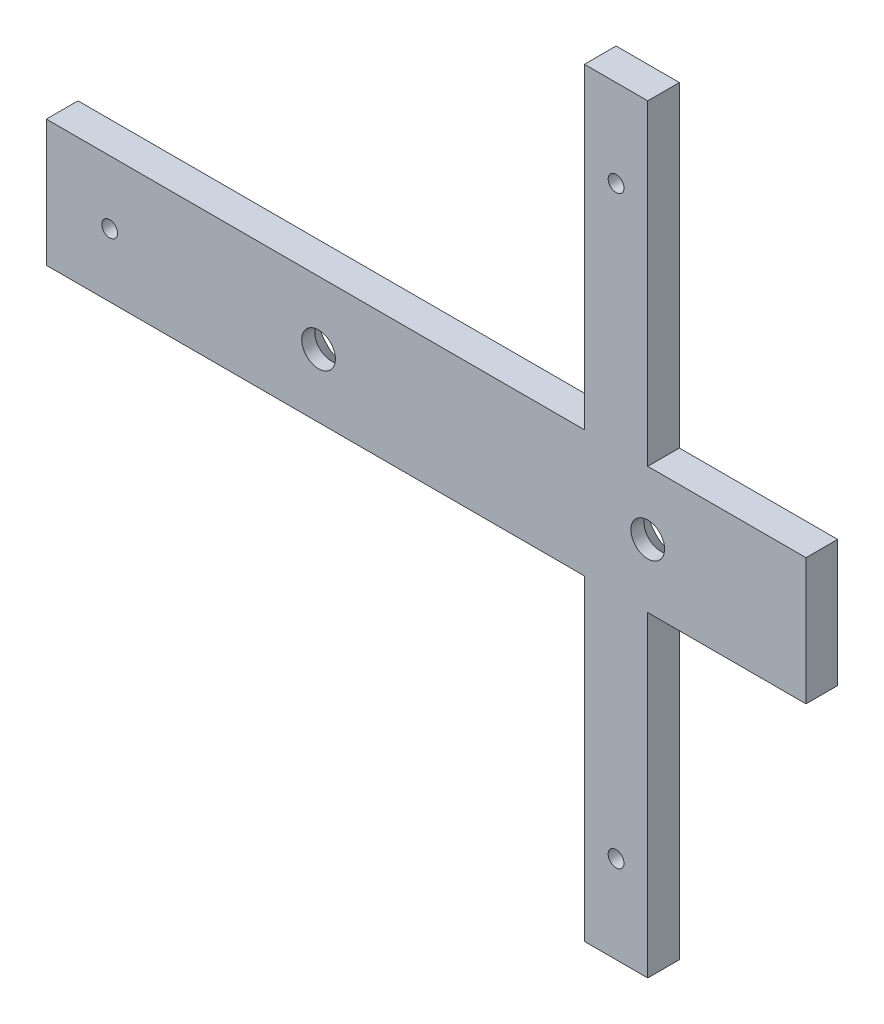
from build123d import *

# Parameters (mm, degrees)
SKETCH1_W         = 152.4
SKETCH1_H         = 152.4
EXTRUDE1_DEPTH    = 6.35
SKETCH2_R         = 1.5875
EXTRUDE2_DEPTH    = 108.95
SKETCH3_OUTSIDE_W = 197.524
SKETCH3_OUTSIDE_H = 197.524
EXTRUDE3_DEPTH    = 108.95


with BuildPart() as part:
    # Sketch1 → Extrude1 (new body)
    with BuildSketch(Plane.XY):
        Rectangle(SKETCH1_W, SKETCH1_H)
    extrude(amount=EXTRUDE1_DEPTH)

    # Sketch2 → Extrude2 (cut, through all)
    with BuildSketch(Plane.XY.offset(6.35)):
        with Locations((-63.5, 0)):
            Circle(SKETCH2_R)
        with Locations((38.1, 58.65878735)):
            Circle(SKETCH2_R)
        with Locations((38.1, -58.65878735)):
            Circle(SKETCH2_R)
    extrude(amount=-EXTRUDE2_DEPTH, mode=Mode.SUBTRACT)

    # Sketch3 outside → Extrude3 (cut, through all)
    with BuildSketch(Plane.XY.offset(6.35)):
        Rectangle(SKETCH3_OUTSIDE_W, SKETCH3_OUTSIDE_H)
        Polygon((-76.2, 12.7), (31.75, 12.7), (31.75, 76.2), (44.45, 76.2), (44.45, 12.7), (76.2, 12.7), (76.2, -12.7), (44.45, -12.7), (44.45, -76.2), (31.75, -76.2), (31.75, -12.7), (-76.2, -12.7), align=None, mode=Mode.SUBTRACT)
    extrude(amount=-EXTRUDE3_DEPTH, mode=Mode.SUBTRACT)

    # Sketch5 → CSK for 1/4 Flat Head Socket Cap Screw1 (revolve, cut)
    with BuildSketch(Plane.YZ.offset(-21.59)):
        Polygon((0, 0), (0, 6.35), (3.3782, 6.35), (3.3782, 3.728390023), (6.61924, 0), align=None)
    revolve(axis=Axis((-21.59, 0, -6.35), (0, 0, 1)), mode=Mode.SUBTRACT)

    # Sketch7 → CSK for 1/4 Flat Head Socket Cap Screw2 (revolve, cut)
    with BuildSketch(Plane.YZ.offset(44.45)):
        Polygon((0, 0), (0, 6.35), (3.3782, 6.35), (3.3782, 3.728390023), (6.61924, 0), align=None)
    revolve(axis=Axis((44.45, 0, -6.35), (0, 0, 1)), mode=Mode.SUBTRACT)


solid = part.part
